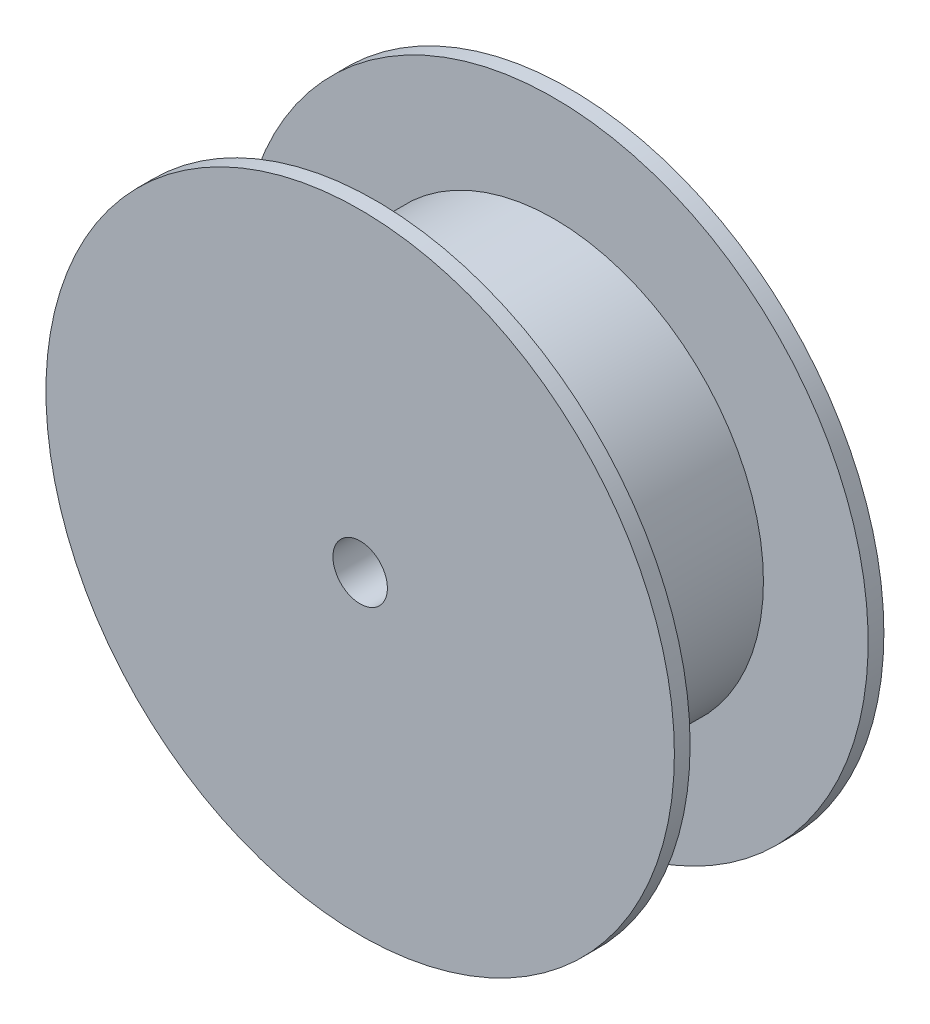
from build123d import *

# Parameters (mm, degrees)
SKETCH1_R               = 30
SKETCH1_R_2             = 20
BOSS_EXTRUDE1_DEPTH     = 10
SKETCH2_OUTSIDE_W       = 79.436
SKETCH2_OUTSIDE_H       = 79.436
SKETCH2_OUTSIDE_R       = 20
CUT_EXTRUDE1_DEPTH      = 3.5
CUT_EXTRUDE3_DEPTH      = 47.904157598
CUT_EXTRUDE3_DEPTH_BACK = 47.904157598
SKETCH4_R               = 2.6
SKETCH5_R               = 30
SKETCH5_R_2             = 20
CUT_EXTRUDE4_DEPTH      = 3


with BuildPart() as part:
    # Sketch1 → Boss-Extrude1 (new, symmetric)
    # profile 1 of 2: a face of its own
    with BuildSketch(Plane.XY):
        Circle(SKETCH1_R)
        Circle(SKETCH1_R_2, mode=Mode.SUBTRACT)
    # profile 2 of 2: a face of its own
    with BuildSketch(Plane.XY):
        Circle(SKETCH1_R_2)
    extrude(amount=BOSS_EXTRUDE1_DEPTH, both=True)

    # Sketch2 outside → Cut-Extrude1 (cut, symmetric)
    with BuildSketch(Plane.XY.offset(5)):
        Rectangle(SKETCH2_OUTSIDE_W, SKETCH2_OUTSIDE_H)
        Circle(SKETCH2_OUTSIDE_R, mode=Mode.SUBTRACT)
    cut_extrude1 = extrude(amount=CUT_EXTRUDE1_DEPTH, both=True, mode=Mode.SUBTRACT)

    # Mirror1: Cut-Extrude1 across plane
    add(cut_extrude1.mirror(Plane.XY), mode=Mode.SUBTRACT)

    # Sketch4 → Cut-Extrude3 (cut, two sides: drawn at the far end of the back side and taken through both)
    with BuildSketch(Plane(origin=(0, 0, -10), x_dir=(-1, 0, 0), z_dir=(0, 0, -1)).offset(-CUT_EXTRUDE3_DEPTH_BACK)):
        Circle(SKETCH4_R)
    extrude(amount=CUT_EXTRUDE3_DEPTH + CUT_EXTRUDE3_DEPTH_BACK, mode=Mode.SUBTRACT)

    # Sketch5 → Cut-Extrude4 (cut)
    with BuildSketch(Plane.XY.offset(1.5)):
        Circle(SKETCH5_R)
        Circle(SKETCH5_R_2, mode=Mode.SUBTRACT)
    extrude(amount=-CUT_EXTRUDE4_DEPTH, mode=Mode.SUBTRACT)


solid = part.part
